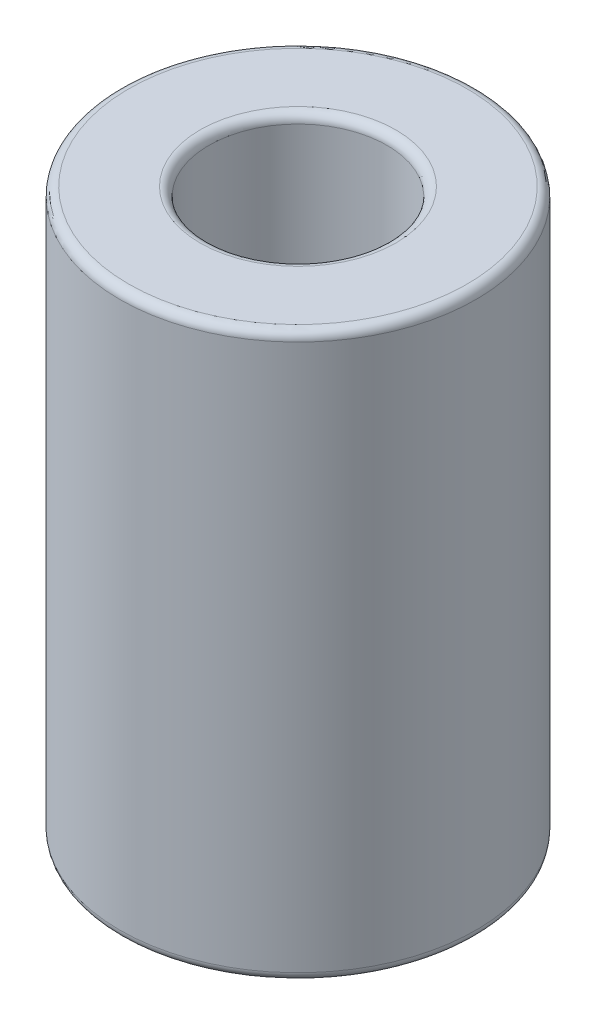
from build123d import *

# Parameters (mm, degrees)
SKETCH1_R           = 6
SKETCH1_R_2         = 3
BOSS_EXTRUDE1_DEPTH = 19
FILLET1_R           = 0.3


with BuildPart() as part:
    # Sketch1 → Boss-Extrude1 (new body)
    with BuildSketch(Plane(origin=(0, 0, 0), x_dir=(1, 0, 0), z_dir=(0, 1, 0))):
        with Locations(Location((0, 0, 0), (0, 0, 270))):
            Circle(SKETCH1_R)
        with Locations(Location((0, 0, 0), (0, 0, 270))):
            Circle(SKETCH1_R_2, mode=Mode.SUBTRACT)
    extrude(amount=BOSS_EXTRUDE1_DEPTH)

    # Fillet1
    fillet1_edges = [part.edges().sort_by_distance(p)[0] for p in [
        (0, 0, -6),
        (0, 19, -6),
        (0, 0, -3),
        (0, 19, -3),
    ]]
    fillet(fillet1_edges, radius=FILLET1_R)


solid = part.part
